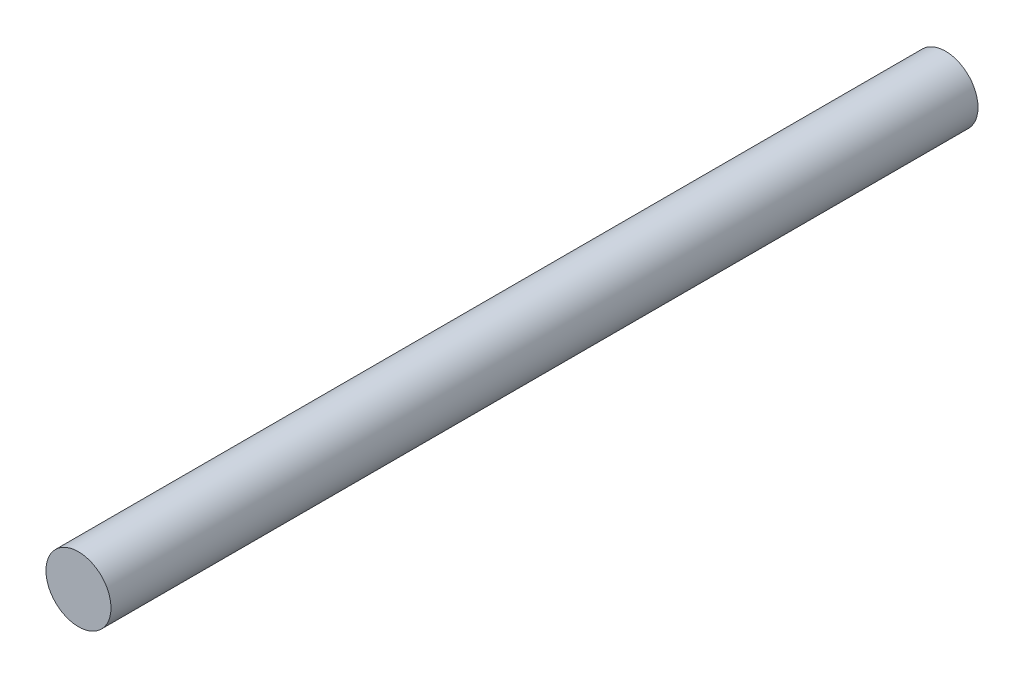
from build123d import *

# Parameters (mm, degrees)
SKETCH1_R           = 4.7625
BOSS_EXTRUDE1_DEPTH = 127


with BuildPart() as part:
    # Sketch1 → Boss-Extrude1 (new body)
    with BuildSketch(Plane.XY):
        Circle(SKETCH1_R)
    extrude(amount=-BOSS_EXTRUDE1_DEPTH)


solid = part.part
